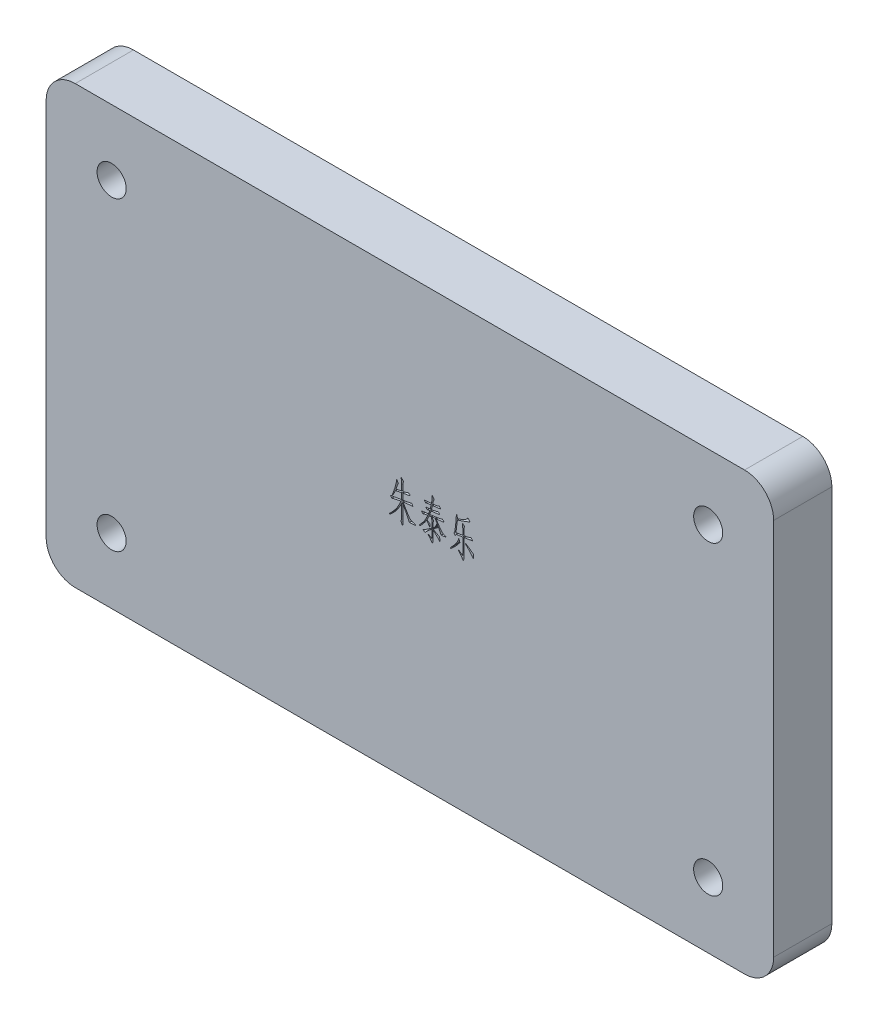
from build123d import *

# Parameters (mm, degrees)
SKETCH_1_R      = 10
EXTRUDE_1_DEPTH = 40


with BuildPart() as part:
    # 草图1 → 凸台-拉伸1 (new body)
    with BuildSketch(Plane.XY):
        with BuildLine():
            Line((-22.077417863, 16.871161249), (437.922582137, 16.871161249))
            ThreePointArc((437.922582137, 16.871161249), (452.064717761, 11.013296872), (457.922582137, -3.128838751))
            Line((457.922582137, -3.128838751), (457.922582137, -263.128838751))
            ThreePointArc((457.922582137, -263.128838751), (452.064717761, -277.270974375), (437.922582137, -283.128838751))
            Line((437.922582137, -283.128838751), (-22.077417863, -283.128838751))
            ThreePointArc((-22.077417863, -283.128838751), (-36.219553486, -277.270974375), (-42.077417863, -263.128838751))
            Line((-42.077417863, -263.128838751), (-42.077417863, -3.128838751))
            ThreePointArc((-42.077417863, -3.128838751), (-36.219553486, 11.013296872), (-22.077417863, 16.871161249))
        make_face()
        with Locations((2.922582137, -28.128838751)):
            Circle(SKETCH_1_R, mode=Mode.SUBTRACT)
        with Locations((2.922582137, -238.128838751)):
            Circle(SKETCH_1_R, mode=Mode.SUBTRACT)
        with Locations((412.922582137, -238.128838751)):
            Circle(SKETCH_1_R, mode=Mode.SUBTRACT)
        with Locations((412.922582137, -28.128838751)):
            Circle(SKETCH_1_R, mode=Mode.SUBTRACT)
        with BuildLine():
            Line((193.751266969, -131.102718666), (194.067492085, -130.73094049))
            add(Edge.make_bspline(
                [(194.067492085, -130.73094049), (194.100643812, -130.704317503), (194.185680249, -130.636027729), (194.325240939, -130.497087706), (194.522655672, -130.317368479), (194.721758842, -130.126010341), (194.9251429, -129.916227214), (195.137052053, -129.689496525), (195.40766143, -129.404376357), (195.727162645, -129.052992716), (196.099153866, -128.638654357), (196.520817568, -128.158961103), (197.000214479, -127.619796539), (197.534317143, -127.025667493), (198.088716776, -126.360751461), (198.6355987, -125.617277044), (199.176388913, -124.804468733), (199.715757452, -123.925399432), (200.240290283, -122.972137978), (200.761026668, -121.949935982), (201.278665359, -120.857640894), (201.605160603, -120.098584266), (201.772274287, -119.710067889)],
                knots=[0, 0, 0, 0, 0.187964212, 0.482141006, 0.869971959, 1.369031568, 1.7031997, 2.162277749, 2.741725131, 3.441883139, 4.262845846, 5.204671127, 6.266836653, 7.454056202, 8.73833837, 10.094250736, 11.534162965, 13.05561804, 14.654686024, 16.345366323, 18.129408288, 20, 20, 20, 20], degree=3))
            add(Edge.make_bspline(
                [(201.772274287, -119.710067889), (201.421774589, -119.773673023), (200.744451706, -119.896586719), (199.765099429, -120.082591737), (198.861601635, -120.272949292), (198.029726982, -120.449180048), (197.273963532, -120.630387861), (196.59020183, -120.802165471), (195.982855525, -120.978597236), (195.604256497, -121.098242694), (195.426405418, -121.15444747)],
                knots=[0, 0, 0, 0, 1.312670999, 2.536670107, 3.673164458, 4.715053788, 5.669917853, 6.53688696, 7.312686476, 8, 8, 8, 8], degree=3))
            Line((195.426405418, -121.15444747), (194.704215628, -120.257051872))
            add(Edge.make_bspline(
                [(194.704215628, -120.257051872), (194.669233953, -120.217992962), (194.608448281, -120.150122508), (194.537226422, -120.049972445), (194.491107063, -119.980997813), (194.462205534, -119.912348152), (194.523159416, -119.854416473), (194.628800997, -119.817288425), (194.802951594, -119.775686084), (194.940622452, -119.753084776), (195.020440743, -119.739981076)],
                knots=[0, 0, 0, 0, 1.256125566, 2.182698182, 2.901226033, 3.322543356, 3.758743219, 4.657992274, 6.062383352, 8, 8, 8, 8], degree=3))
            Line((195.020440743, -119.739981076), (197.704080911, -119.363929587))
            Line((197.704080911, -119.363929587), (199.981756404, -118.987878099))
            Line((199.981756404, -118.987878099), (202.289345084, -118.586186736))
            Line((202.289345084, -118.586186736), (202.289345084, -114.488080173))
            Line((202.289345084, -114.488080173), (198.020306027, -115.270096337))
            add(Edge.make_bspline(
                [(198.020306027, -115.270096337), (197.934818289, -115.456685513), (197.770224643, -115.815934614), (197.534321268, -116.331769708), (197.307283346, -116.796796969), (197.114022873, -117.223435828), (196.930309441, -117.599603812), (196.767221614, -117.931865736), (196.622645701, -118.216418071), (196.531879604, -118.39109621), (196.490460198, -118.470807302)],
                knots=[0, 0, 0, 0, 1.388358777, 2.673073827, 3.836746385, 4.888613906, 5.841025903, 6.668395757, 7.392347385, 8, 8, 8, 8], degree=3))
            Line((196.490460198, -118.470807302), (196.174235083, -119.017791285))
            Line((196.174235083, -119.017791285), (195.858009968, -118.671652983))
            Line((195.858009968, -118.671652983), (196.028942462, -118.325514681))
            add(Edge.make_bspline(
                [(196.028942462, -118.325514681), (196.064830977, -118.244442241), (196.15190403, -118.047743522), (196.297129824, -117.696345918), (196.474661432, -117.233462184), (196.763282279, -116.478119257), (197.128190775, -115.479580977), (197.518763689, -114.274355278), (197.86136368, -113.095194195), (198.112463709, -112.131240797), (198.289107418, -111.399057482), (198.402742283, -110.915567489), (198.488315059, -110.492043403), (198.551502404, -110.128371176), (198.601736007, -109.823823574), (198.627360825, -109.576551516), (198.654646315, -109.38915174), (198.656343798, -109.283240179), (198.65702957, -109.240452584)],
                knots=[0, 0, 0, 0, 0.448555804, 1.088290317, 1.92339773, 2.956674201, 5.179390362, 7.301161946, 9.365162416, 11.391066708, 12.340192607, 13.17582848, 13.903705564, 14.525740545, 15.043521023, 15.464543049, 15.783678808, 16, 16, 16, 16], degree=3))
            Line((198.65702957, -109.240452584), (198.56729001, -108.372970173))
            Line((198.56729001, -108.372970173), (198.827962064, -108.202037678))
            Line((198.827962064, -108.202037678), (200.067222652, -110.133574869))
            add(Edge.make_bspline(
                [(200.067222652, -110.133574869), (199.957914725, -110.249113873), (199.730308775, -110.489694456), (199.544669944, -110.834452556), (199.428432823, -111.121678412), (199.350632646, -111.354816405), (199.240725779, -111.656138858), (199.119817716, -112.033740948), (198.973242843, -112.480129053), (198.812334764, -113.001433162), (198.623065711, -113.59128497), (198.494165406, -114.010743265), (198.426270702, -114.231681431)],
                knots=[0, 0, 0, 0, 1.067939138, 2.223711576, 2.606838485, 3.156172787, 3.878504666, 4.767641592, 5.82674891, 7.043800617, 8.442902959, 10, 10, 10, 10], degree=3))
            Line((198.426270702, -114.231681431), (202.289345084, -113.479578454))
            Line((202.289345084, -113.479578454), (202.289345084, -109.642143946))
            add(Edge.make_bspline(
                [(202.289345084, -109.642143946), (202.28963371, -109.512520766), (202.290182438, -109.266085595), (202.286482239, -108.912770391), (202.27630483, -108.593770053), (202.270161636, -108.308723838), (202.25539073, -108.058151803), (202.24436321, -107.841422102), (202.228179139, -107.657387222), (202.19714926, -107.446295606), (202.145240606, -107.173884366), (202.062992754, -106.8064824), (201.956372394, -106.371872331), (201.87265312, -106.06093437), (201.827827348, -105.894448998)],
                knots=[0, 0, 0, 0, 1.229596448, 2.337666843, 3.351430766, 4.257141296, 5.041887779, 5.732193482, 6.315720038, 6.793443108, 7.755459236, 8.945517168, 10.364539649, 12, 12, 12, 12], degree=3))
            Line((201.827827348, -105.894448998), (202.088499402, -105.578223883))
            Line((202.088499402, -105.578223883), (203.558518857, -107.279002206))
            add(Edge.make_bspline(
                [(203.558518857, -107.279002206), (203.506640151, -107.388354504), (203.409877755, -107.592314686), (203.275603353, -107.89999122), (203.187309058, -108.240674729), (203.140523563, -108.566733605), (203.120992216, -108.884187117), (203.108201624, -109.180520015), (203.100070824, -109.525300139), (203.09806675, -109.771763733), (203.097001122, -109.902816001)],
                knots=[0, 0, 0, 0, 1.076880918, 2.008561614, 2.979719072, 4.196290932, 4.932849195, 5.807848978, 6.834365919, 8, 8, 8, 8], degree=3))
            Line((203.097001122, -109.902816001), (203.097001122, -113.334285834))
            add(Edge.make_bspline(
                [(203.097001122, -113.334285834), (203.330921474, -113.285825973), (203.780023168, -113.192788299), (204.423079482, -113.036270511), (205.010766742, -112.884947037), (205.540915451, -112.731202824), (206.013922927, -112.579067676), (206.42809516, -112.420247484), (206.789338931, -112.265314517), (207.004928271, -112.149146289), (207.105368124, -112.095025247)],
                knots=[0, 0, 0, 0, 1.361837192, 2.614579633, 3.772784231, 4.821369281, 5.761303325, 6.604402958, 7.349812186, 8, 8, 8, 8], degree=3))
            Line((207.105368124, -112.095025247), (207.942937349, -113.018060718))
            add(Edge.make_bspline(
                [(207.942937349, -113.018060718), (207.982590343, -113.073397597), (208.047357412, -113.163781881), (208.088847713, -113.310862974), (208.025388741, -113.420778035), (207.953477006, -113.439265454), (207.913024162, -113.449665268)],
                knots=[0, 0, 0, 0, 1.493413349, 2.439261119, 3.122030279, 4, 4, 4, 4], degree=3))
            Line((207.913024162, -113.449665268), (203.097001122, -114.317147679))
            Line((203.097001122, -114.317147679), (203.097001122, -118.470807302))
            add(Edge.make_bspline(
                [(203.097001122, -118.470807302), (203.456116141, -118.426438019), (204.142314247, -118.341657055), (205.121220025, -118.201410812), (206.002703282, -118.055045736), (206.787223878, -117.913066822), (207.474682195, -117.764668979), (208.063944889, -117.609555292), (208.561450935, -117.464512319), (208.851144185, -117.342113999), (208.981352254, -117.287099776)],
                knots=[0, 0, 0, 0, 1.442996166, 2.757281605, 3.943308322, 5.006225767, 5.936606997, 6.746759072, 7.436707337, 8, 8, 8, 8], degree=3))
            Line((208.981352254, -117.287099776), (209.818921479, -118.355427868))
            add(Edge.make_bspline(
                [(209.818921479, -118.355427868), (209.849470961, -118.408012273), (209.903923113, -118.501740013), (209.932054891, -118.645410054), (209.879022264, -118.771837742), (209.800389572, -118.781800441), (209.759095106, -118.787032417)],
                knots=[0, 0, 0, 0, 1.332594706, 2.375249681, 3.146751879, 4, 4, 4, 4], degree=3))
            Line((209.759095106, -118.787032417), (207.451506426, -118.962238224))
            Line((207.451506426, -118.962238224), (205.002898438, -119.27846334))
            Line((205.002898438, -119.27846334), (203.297846803, -119.539135394))
            Line((203.297846803, -119.539135394), (204.712313197, -122.077482942))
            Line((204.712313197, -122.077482942), (206.789143009, -125.479039588))
            add(Edge.make_bspline(
                [(206.789143009, -125.479039588), (206.878906871, -125.626666671), (207.051821121, -125.911044211), (207.32409419, -126.307170242), (207.580004407, -126.669622796), (207.844181865, -126.981392159), (208.098040789, -127.25701418), (208.352330568, -127.488180728), (208.597065217, -127.684584979), (208.943174969, -127.885604657), (209.42944853, -128.09886754), (210.102943941, -128.326327031), (210.897447375, -128.547955846), (211.473356393, -128.672945367), (211.780371856, -128.739576926)],
                knots=[0, 0, 0, 0, 0.997183308, 1.920897779, 2.774570547, 3.556858739, 4.278256875, 4.935961144, 5.539626952, 6.085404219, 7.240994938, 8.598500683, 10.186670367, 12, 12, 12, 12], degree=3))
            Line((211.780371856, -128.739576926), (211.780371856, -129.201094662))
            Line((211.780371856, -129.201094662), (207.626712233, -129.48740659))
            Line((207.626712233, -129.48740659), (204.887519004, -124.038933319))
            Line((204.887519004, -124.038933319), (203.097001122, -120.633103361))
            Line((203.097001122, -120.633103361), (203.067087935, -131.423217094))
            add(Edge.make_bspline(
                [(203.067087935, -131.423217094), (203.064812924, -131.604132905), (203.060549039, -131.943210113), (203.046120713, -132.417488029), (203.03516637, -132.823573511), (203.018489274, -133.161309365), (202.998521049, -133.429304447), (202.974636652, -133.629558375), (202.947049155, -133.761535416), (202.916783897, -133.849288842), (202.852617225, -133.892245583), (202.781132395, -133.857972023), (202.73216481, -133.779162999), (202.709139967, -133.711576325), (202.695309759, -133.6709794)],
                knots=[0, 0, 0, 0, 2.343960736, 4.393113347, 6.147126351, 7.606867474, 8.773131274, 9.629210383, 10.215690716, 10.521160351, 10.818723701, 11.07575951, 11.444841421, 12, 12, 12, 12], degree=3))
            Line((202.695309759, -133.6709794), (202.058586216, -132.141133572))
            add(Edge.make_bspline(
                [(202.058586216, -132.141133572), (202.012825417, -132.0388077), (201.932975769, -131.860255638), (201.833518394, -131.630501273), (201.775969424, -131.482442132), (201.747278122, -131.38509043), (201.776703656, -131.31311623), (201.81698038, -131.227277707), (201.869494401, -131.10355228), (201.974139565, -130.906516513), (202.086704831, -130.648018772), (202.157292105, -130.377664299), (202.186369782, -130.153210861), (202.195080669, -129.951743944), (202.210550498, -129.712639904), (202.216705691, -129.448944833), (202.222920456, -129.180994209), (202.239107089, -128.93626858), (202.244140758, -128.725112772), (202.254642832, -128.597104479), (202.259431897, -128.538731244)],
                knots=[0, 0, 0, 0, 1.618232742, 2.823712003, 3.590537451, 3.945084, 4.224435491, 4.674876236, 5.327594578, 6.154246419, 7.893710821, 9.378164718, 10.165348301, 11.153111738, 12.284399055, 13.620022312, 14.955645568, 16.148461142, 17.155677268, 18, 18, 18, 18], degree=3))
            Line((202.259431897, -128.538731244), (202.289345084, -121.039068036))
            add(Edge.make_bspline(
                [(202.289345084, -121.039068036), (202.02456271, -121.53072696), (201.505745884, -122.494087617), (200.691808833, -123.882730542), (199.845242445, -125.175977799), (198.994358504, -126.396547393), (198.105894296, -127.52955449), (197.182803453, -128.583505121), (196.218792749, -129.558467006), (195.534360206, -130.148405192), (195.19564655, -130.440355249)],
                knots=[0, 0, 0, 0, 1.130599819, 2.215306855, 3.257628486, 4.259413885, 5.226941431, 6.171091226, 7.094905138, 8, 8, 8, 8], degree=3))
            Line((195.19564655, -130.440355249), (194.272611079, -131.2180981))
            Line((194.272611079, -131.2180981), (193.866646403, -131.564236402))
            Line((193.866646403, -131.564236402), (193.751266969, -131.102718666))
        make_face(mode=Mode.SUBTRACT)
        with BuildLine():
            Line((214.481105274, -127.410576779), (215.228934938, -126.602920741))
            add(Edge.make_bspline(
                [(215.228934938, -126.602920741), (215.439064642, -126.372825437), (215.847271596, -125.925832455), (216.428202827, -125.265507556), (216.956733133, -124.633464565), (217.425150292, -124.024182345), (217.85072137, -123.450694866), (218.218104846, -122.902002773), (218.538359101, -122.385068356), (218.879046201, -121.744566026), (219.234696237, -121.003604322), (219.639008965, -120.202121374), (219.974021646, -119.491502597), (220.180368847, -119.05059255), (220.275716847, -118.84685879)],
                knots=[0, 0, 0, 0, 1.204587963, 2.34008412, 3.399773012, 4.388879473, 5.310738458, 6.159899105, 6.940925196, 7.660354251, 8.96309413, 10.11807748, 11.130409584, 12, 12, 12, 12], degree=3))
            add(Edge.make_bspline(
                [(220.275716847, -118.84685879), (220.004551664, -118.886617691), (219.44805122, -118.968213145), (218.599789185, -119.152049043), (217.715004752, -119.385349652), (217.119664458, -119.580214747), (216.814333828, -119.680154702)],
                knots=[0, 0, 0, 0, 0.922075282, 1.892334773, 2.919047211, 4, 4, 4, 4], degree=3))
            Line((216.814333828, -119.680154702), (216.00667779, -118.757119231))
            add(Edge.make_bspline(
                [(216.00667779, -118.757119231), (215.976666327, -118.719639836), (215.920554693, -118.649565608), (215.883632784, -118.509971435), (215.984863383, -118.381433948), (216.089705076, -118.365117929), (216.15197041, -118.355427868)],
                knots=[0, 0, 0, 0, 0.997517539, 1.865032041, 2.732045523, 4, 4, 4, 4], degree=3))
            add(Edge.make_bspline(
                [(216.15197041, -118.355427868), (216.377026505, -118.336891715), (216.798727854, -118.302159392), (217.384644081, -118.25417821), (217.879798737, -118.199994451), (218.178935613, -118.168727496), (218.314266469, -118.154582187)],
                knots=[0, 0, 0, 0, 1.247797595, 2.338074553, 3.248137516, 4, 4, 4, 4], degree=3))
            Line((218.314266469, -118.154582187), (220.681681522, -117.893910132))
            add(Edge.make_bspline(
                [(220.681681522, -117.893910132), (220.764166978, -117.663104899), (220.925042616, -117.212953555), (221.162094672, -116.556572153), (221.375798123, -115.930703191), (221.509642111, -115.523766006), (221.574803807, -115.325649398)],
                knots=[0, 0, 0, 0, 1.081630591, 2.109559896, 3.079642767, 4, 4, 4, 4], degree=3))
            add(Edge.make_bspline(
                [(221.574803807, -115.325649398), (221.397843, -115.358250649), (221.063877561, -115.419776652), (220.598803285, -115.530212467), (220.196671372, -115.647370816), (219.956059562, -115.742777933), (219.844112298, -115.787167134)],
                knots=[0, 0, 0, 0, 1.202905152, 2.270156622, 3.195171529, 4, 4, 4, 4], degree=3))
            Line((219.844112298, -115.787167134), (218.980903199, -114.979511096))
            add(Edge.make_bspline(
                [(218.980903199, -114.979511096), (218.950578302, -114.949419835), (218.892341466, -114.891631682), (218.86412567, -114.780432069), (218.909576256, -114.692517016), (218.999061747, -114.640412257), (219.133134566, -114.60671888), (219.23711374, -114.588395563), (219.297128314, -114.577819733)],
                knots=[0, 0, 0, 0, 1.052663628, 2.021566598, 2.573869921, 3.386200027, 4.491370104, 6, 6, 6, 6], degree=3))
            Line((219.297128314, -114.577819733), (219.814199111, -114.547906547))
            add(Edge.make_bspline(
                [(219.814199111, -114.547906547), (219.845561712, -114.546821292), (219.932755664, -114.543804079), (220.09763741, -114.523088301), (220.335831511, -114.499274535), (220.517929674, -114.475823862), (220.621855149, -114.462440299)],
                knots=[0, 0, 0, 0, 0.463376835, 1.288275088, 2.452388022, 4, 4, 4, 4], degree=3))
            Line((220.621855149, -114.462440299), (221.865389048, -114.317147679))
            add(Edge.make_bspline(
                [(221.865389048, -114.317147679), (221.986681778, -113.880943877), (222.236238312, -112.983466274), (222.428788195, -112.072038204), (222.527752466, -111.603594324)],
                knots=[0, 0, 0, 0, 0.972066155, 2, 2, 2, 2], degree=3))
            add(Edge.make_bspline(
                [(222.527752466, -111.603594324), (222.293995497, -111.635355336), (221.848823952, -111.695841655), (221.217298541, -111.797470232), (220.652106449, -111.883476241), (220.156770109, -111.974418613), (219.729070142, -112.058630118), (219.369986836, -112.139655302), (219.078124702, -112.213444348), (218.909418093, -112.270784962), (218.835610578, -112.295870928)],
                knots=[0, 0, 0, 0, 1.505363151, 2.866844326, 4.081825289, 5.153414892, 6.080425348, 6.86328174, 7.502696723, 8, 8, 8, 8], degree=3))
            Line((218.835610578, -112.295870928), (218.02795454, -111.347195582))
            add(Edge.make_bspline(
                [(218.02795454, -111.347195582), (217.990018718, -111.309820036), (217.933283939, -111.253923176), (217.881863716, -111.151059681), (217.921736285, -111.092262447), (217.952282789, -111.032784156), (218.056426707, -111.018169435), (218.210103456, -110.989132427), (218.464688854, -110.969118058), (218.662182825, -110.95141434), (218.775784205, -110.941230907)],
                knots=[0, 0, 0, 0, 1.097726399, 1.641700688, 2.052192079, 2.442145727, 2.922741873, 3.997387523, 5.697639574, 8, 8, 8, 8], degree=3))
            Line((218.775784205, -110.941230907), (219.698819677, -110.885677846))
            Line((219.698819677, -110.885677846), (221.344044939, -110.770298412))
            Line((221.344044939, -110.770298412), (222.728598147, -110.625005791))
            add(Edge.make_bspline(
                [(222.728598147, -110.625005791), (222.763629094, -110.452809149), (222.831248494, -110.120422079), (222.91541835, -109.636962846), (222.988869981, -109.188340638), (223.048452068, -108.773739411), (223.097292023, -108.395068896), (223.126709709, -108.04998334), (223.145013571, -107.739314441), (223.149347263, -107.377254391), (223.140870296, -106.972597544), (223.123234665, -106.529621585), (223.103215495, -106.137747831), (223.083781805, -105.892990957), (223.074736449, -105.779069564)],
                knots=[0, 0, 0, 0, 1.296175992, 2.50197758, 3.619632, 4.649420737, 5.591704021, 6.435515913, 7.203714152, 7.886782559, 9.105833862, 10.188922305, 11.157039023, 12, 12, 12, 12], degree=3))
            Line((223.074736449, -105.779069564), (223.335408503, -105.51839751))
            Line((223.335408503, -105.51839751), (224.634495464, -107.509761074))
            add(Edge.make_bspline(
                [(224.634495464, -107.509761074), (224.574277675, -107.57814317), (224.455502463, -107.713021885), (224.30943958, -107.939638134), (224.189476597, -108.179130444), (224.11049784, -108.394876505), (224.052774949, -108.588219318), (224.013648744, -108.767948351), (223.959990189, -108.977825543), (223.9039287, -109.221072906), (223.852057644, -109.498769369), (223.783789331, -109.806468573), (223.723751597, -110.148268693), (223.676346797, -110.385797368), (223.651633619, -110.509626358)],
                knots=[0, 0, 0, 0, 1.023618767, 2.019013623, 3.022114876, 4.030957296, 4.598758827, 5.290469846, 6.098719696, 7.035392193, 8.09740992, 9.275721729, 10.579773043, 12, 12, 12, 12], degree=3))
            Line((223.651633619, -110.509626358), (225.58317081, -110.27886749))
            add(Edge.make_bspline(
                [(225.58317081, -110.27886749), (225.829301261, -110.247514015), (226.297465468, -110.187876637), (226.947410803, -110.014946926), (227.523079722, -109.818425128), (227.850686274, -109.620623433), (228.006138923, -109.526764513)],
                knots=[0, 0, 0, 0, 1.161977707, 2.210195322, 3.15071943, 4, 4, 4, 4], degree=3))
            Line((228.006138923, -109.526764513), (228.929174395, -110.449799984))
            add(Edge.make_bspline(
                [(228.929174395, -110.449799984), (228.961265039, -110.500588934), (229.017204222, -110.589122291), (229.0475023, -110.728112941), (228.990406309, -110.845596902), (228.914631399, -110.852194162), (228.873621334, -110.855764659)],
                knots=[0, 0, 0, 0, 1.367035271, 2.382963634, 3.124845346, 4, 4, 4, 4], degree=3))
            Line((228.873621334, -110.855764659), (223.450787937, -111.518128077))
            add(Edge.make_bspline(
                [(223.450787937, -111.518128077), (223.390955456, -111.734279685), (223.263922587, -112.19320029), (223.100283505, -112.898022287), (222.946019727, -113.590705717), (222.817528038, -114.029939667), (222.758511334, -114.231681431)],
                knots=[0, 0, 0, 0, 0.960764135, 2.039838902, 3.099690818, 4, 4, 4, 4], degree=3))
            Line((222.758511334, -114.231681431), (224.544755904, -114.000922563))
            add(Edge.make_bspline(
                [(224.544755904, -114.000922563), (224.813600563, -113.962020645), (225.330214362, -113.887266443), (226.061669127, -113.694653905), (226.7268244, -113.46066594), (227.122666376, -113.240016305), (227.313862319, -113.133440152)],
                knots=[0, 0, 0, 0, 1.114638722, 2.141897649, 3.102516528, 4, 4, 4, 4], degree=3))
            Line((227.313862319, -113.133440152), (228.121518357, -114.086388811))
            add(Edge.make_bspline(
                [(228.121518357, -114.086388811), (228.168985247, -114.144061933), (228.24880924, -114.241049516), (228.284309679, -114.404977864), (228.226730186, -114.526137961), (228.155783651, -114.540816973), (228.121518357, -114.547906547)],
                knots=[0, 0, 0, 0, 1.528933803, 2.571173353, 3.309914628, 4, 4, 4, 4], degree=3))
            Line((228.121518357, -114.547906547), (222.467926092, -115.240183151))
            add(Edge.make_bspline(
                [(222.467926092, -115.240183151), (222.414280792, -115.411270316), (222.298640431, -115.780073951), (222.10165877, -116.370235274), (221.866138913, -117.034847013), (221.694911654, -117.502355501), (221.604716994, -117.748617511)],
                knots=[0, 0, 0, 0, 0.810954206, 1.748131472, 2.813819033, 4, 4, 4, 4], degree=3))
            Line((221.604716994, -117.748617511), (225.382325128, -117.257186589))
            add(Edge.make_bspline(
                [(225.382325128, -117.257186589), (225.688789224, -117.21731595), (226.272559324, -117.141368108), (227.101102412, -117.010847022), (227.840793673, -116.888145981), (228.485234038, -116.748849394), (229.040785721, -116.61731005), (229.500259999, -116.470826416), (229.875181104, -116.332978711), (230.081236526, -116.215409669), (230.172708295, -116.163218622)],
                knots=[0, 0, 0, 0, 1.501851041, 2.860810596, 4.076304916, 5.144842173, 6.06493159, 6.84875319, 7.4889405, 8, 8, 8, 8], degree=3))
            Line((230.172708295, -116.163218622), (231.2111232, -117.257186589))
            add(Edge.make_bspline(
                [(231.2111232, -117.257186589), (231.226467687, -117.289475602), (231.259208017, -117.358370244), (231.256670661, -117.468281892), (231.217288506, -117.588964629), (231.137824603, -117.598353126), (231.095743766, -117.603324891)],
                knots=[0, 0, 0, 0, 0.949316421, 2.025543975, 2.954408762, 4, 4, 4, 4], degree=3))
            Line((231.095743766, -117.603324891), (226.019048671, -118.154582187))
            Line((226.019048671, -118.154582187), (226.566032655, -119.192997092))
            Line((226.566032655, -119.192997092), (227.172843011, -120.201498811))
            Line((227.172843011, -120.201498811), (228.382190412, -122.077482942))
            add(Edge.make_bspline(
                [(228.382190412, -122.077482942), (228.444764217, -122.178240215), (228.576667463, -122.390632784), (228.816607583, -122.703379105), (229.084991274, -123.044178635), (229.390652148, -123.392987275), (229.712667162, -123.738581286), (230.05345528, -124.043918522), (230.38615549, -124.321339762), (230.732846789, -124.566213153), (231.124612889, -124.777012367), (231.576679083, -124.966800999), (232.103108043, -125.137766065), (232.481004461, -125.229572295), (232.681142655, -125.278193906)],
                knots=[0, 0, 0, 0, 0.772128462, 1.627617958, 2.565163869, 3.597753307, 4.647828339, 5.639591055, 6.575758559, 7.468911476, 8.398989721, 9.467473198, 10.658745312, 12, 12, 12, 12], degree=3))
            Line((232.681142655, -125.278193906), (232.681142655, -125.795264703))
            Line((232.681142655, -125.795264703), (229.450518504, -126.141403005))
            Line((229.450518504, -126.141403005), (228.583036093, -124.440624682))
            Line((228.583036093, -124.440624682), (228.03605211, -123.37229659))
            Line((228.03605211, -123.37229659), (225.296858881, -118.240048434))
            Line((225.296858881, -118.240048434), (223.019183388, -118.500720488))
            Line((223.019183388, -118.500720488), (224.198617602, -120.116032564))
            add(Edge.make_bspline(
                [(224.198617602, -120.116032564), (224.139167205, -120.310157024), (224.030439711, -120.665186886), (223.93183366, -121.182576856), (223.888346331, -121.672095231), (223.884432262, -121.994783577), (223.882392487, -122.162949189)],
                knots=[0, 0, 0, 0, 1.16993673, 2.13967099, 3.030509248, 4, 4, 4, 4], degree=3))
            Line((223.882392487, -122.162949189), (223.882392487, -124.846589357))
            add(Edge.make_bspline(
                [(223.882392487, -124.846589357), (223.987437845, -124.718092761), (224.188522862, -124.472115777), (224.482628165, -124.124038731), (224.738647899, -123.796578306), (224.967194392, -123.499703192), (225.171152268, -123.234164578), (225.340980721, -122.995361125), (225.483117057, -122.786539458), (225.702159154, -122.431689134), (225.9809563, -121.890009616), (226.15890618, -121.383349339), (226.249807539, -121.124534283)],
                knots=[0, 0, 0, 0, 1.120293098, 2.14454177, 3.075552197, 3.925589571, 4.673640355, 5.335325817, 5.903339057, 6.378281147, 8.14993318, 10, 10, 10, 10], degree=3))
            Line((226.249807539, -121.124534283), (226.506206282, -121.094621097))
            Line((226.506206282, -121.094621097), (226.942084143, -123.201364095))
            add(Edge.make_bspline(
                [(226.942084143, -123.201364095), (226.769677759, -123.254076678), (226.436773643, -123.355860821), (226.094108213, -123.562673365), (225.871397855, -123.738602078), (225.7149997, -123.865803334), (225.517016373, -124.029623399), (225.278142398, -124.229326971), (225.001963576, -124.469074285), (224.684016096, -124.743641155), (224.325459025, -125.054431549), (224.074481434, -125.276529851), (223.94221886, -125.39357334)],
                knots=[0, 0, 0, 0, 1.438611379, 2.777853342, 3.167792367, 3.710818861, 4.391006554, 5.224452859, 6.202527906, 7.317862354, 8.586541427, 10, 10, 10, 10], degree=3))
            Line((223.94221886, -125.39357334), (227.920672676, -127.615695773))
            Line((227.920672676, -127.615695773), (228.266810978, -127.786628267))
            add(Edge.make_bspline(
                [(228.266810978, -127.786628267), (228.282014584, -127.813268731), (228.31804411, -127.876401337), (228.353458584, -128.001659873), (228.386580667, -128.167329629), (228.403002324, -128.293563573), (228.412103598, -128.363525437)],
                knots=[0, 0, 0, 0, 0.612617375, 1.451781485, 2.587716485, 4, 4, 4, 4], degree=3))
            Line((228.412103598, -128.363525437), (228.583036093, -130.008750699))
            add(Edge.make_bspline(
                [(228.583036093, -130.008750699), (228.581770946, -130.047366229), (228.577975505, -130.163212817), (228.567332627, -130.309970802), (228.572544712, -130.451607515), (228.490839216, -130.510375568), (228.406804878, -130.422086576), (228.358087149, -130.36307246), (228.326637351, -130.324975815)],
                knots=[0, 0, 0, 0, 0.917355376, 2.752066127, 3.617697242, 4.060388189, 4.747880917, 6, 6, 6, 6], degree=3))
            Line((228.326637351, -130.324975815), (228.006138923, -129.923284452))
            add(Edge.make_bspline(
                [(228.006138923, -129.923284452), (227.884113432, -129.779010769), (227.646735557, -129.498353178), (227.292116508, -129.095137454), (226.947362986, -128.725930065), (226.660283836, -128.430265787), (226.412347801, -128.186573333), (226.17959289, -127.975099613), (225.909344254, -127.722265265), (225.589048329, -127.440282227), (225.229061188, -127.118899275), (224.815668088, -126.770919697), (224.36479325, -126.381036552), (224.047820753, -126.111264708), (223.882392487, -125.97047051)],
                knots=[0, 0, 0, 0, 1.188864515, 2.312714579, 3.378044508, 4.366730399, 4.905430465, 5.564987527, 6.345108029, 7.233764653, 8.249696585, 9.381203484, 10.633247447, 12, 12, 12, 12], degree=3))
            Line((223.882392487, -125.97047051), (223.882392487, -130.324975815))
            add(Edge.make_bspline(
                [(223.882392487, -130.324975815), (223.880992943, -130.380527779), (223.877547326, -130.517294347), (223.870598284, -130.761129112), (223.845313659, -131.081268653), (223.822840211, -131.451721083), (223.799321004, -131.82212011), (223.775164671, -132.142363875), (223.76563564, -132.390590383), (223.750407516, -132.582748029), (223.737247276, -132.753929318), (223.715524883, -132.93938758), (223.680636761, -133.157329652), (223.63592635, -133.392431532), (223.59174316, -133.613346677), (223.538891103, -133.786626626), (223.484023115, -133.897680473), (223.405290355, -133.963879659), (223.30576023, -133.923076991), (223.215389508, -133.828992561), (223.088191599, -133.687989715), (223.006081384, -133.568208023), (222.959357015, -133.500046905)],
                knots=[0, 0, 0, 0, 0.767003296, 1.888329408, 3.366124187, 5.198332357, 7.010921469, 8.488716248, 9.630537376, 10.438764193, 11.148987891, 12.000076342, 13.015012, 14.194956983, 15.301710788, 16.128612365, 16.674871301, 17.029302207, 17.396586721, 17.995822534, 18.859533748, 20, 20, 20, 20], degree=3))
            Line((222.959357015, -133.500046905), (222.467926092, -132.807770301))
            Line((222.467926092, -132.807770301), (221.660270055, -131.709529023))
            Line((221.660270055, -131.709529023), (220.450922654, -130.295062628))
            Line((220.450922654, -130.295062628), (220.651768335, -129.807905018))
            Line((220.651768335, -129.807905018), (222.12178779, -130.871959798))
            add(Edge.make_bspline(
                [(222.12178779, -130.871959798), (222.223528905, -130.948602773), (222.398992795, -131.080782123), (222.631451857, -131.252039782), (222.771298584, -131.339232566), (222.855610084, -131.424545726), (222.912411679, -131.387557138), (222.940018786, -131.320011064), (222.973171299, -131.213999163), (223.009527504, -131.05432933), (223.036939709, -130.822734372), (223.062905449, -130.503546483), (223.072305699, -130.085711878), (223.073868946, -129.775135894), (223.074736449, -129.602786024)],
                knots=[0, 0, 0, 0, 1.666996254, 2.874920798, 3.656591931, 3.996613968, 4.145944563, 4.444605751, 4.930790941, 5.595786236, 6.567627243, 7.961229022, 9.758739611, 12, 12, 12, 12], degree=3))
            Line((223.074736449, -129.602786024), (223.074736449, -125.739711642))
            add(Edge.make_bspline(
                [(223.074736449, -125.739711642), (222.835032279, -125.937229745), (222.381522854, -126.310925041), (221.747556368, -126.845551349), (221.18908204, -127.312371292), (220.711783217, -127.715162076), (220.318030824, -128.059637601), (220.000053373, -128.336876059), (219.762933116, -128.551334116), (219.546990826, -128.758889429), (219.327707008, -129.005473608), (219.049402482, -129.317648807), (218.751140595, -129.689656123), (218.540638245, -129.95454698), (218.429645903, -130.094216947)],
                knots=[0, 0, 0, 0, 1.75108217, 3.312968087, 4.675375631, 5.854797308, 6.833885805, 7.624860068, 8.233130246, 8.636348814, 9.312695054, 10.092336251, 10.994139184, 12, 12, 12, 12], degree=3))
            Line((218.429645903, -130.094216947), (217.365591123, -129.401940343))
            add(Edge.make_bspline(
                [(217.365591123, -129.401940343), (217.319215723, -129.371668627), (217.238125468, -129.318736659), (217.142571574, -129.237557299), (217.082589689, -129.171250921), (217.065141872, -129.092108982), (217.137601553, -129.022312879), (217.243431508, -128.940050521), (217.412363961, -128.828755189), (217.546131523, -128.75275994), (217.621989865, -128.709663739)],
                knots=[0, 0, 0, 0, 1.195118225, 2.089738122, 2.705255323, 3.110048562, 3.682512651, 4.667820928, 6.110352168, 8, 8, 8, 8], degree=3))
            Line((217.621989865, -128.709663739), (218.344179656, -128.27805919))
            Line((218.344179656, -128.27805919), (219.527887182, -127.555869399))
            Line((219.527887182, -127.555869399), (221.027819824, -126.517454494))
            Line((221.027819824, -126.517454494), (223.074736449, -125.077348225))
            Line((223.074736449, -125.077348225), (223.074736449, -122.449261118))
            add(Edge.make_bspline(
                [(223.074736449, -122.449261118), (223.072267814, -122.131518548), (223.067602932, -121.531092816), (223.018975722, -120.788579531), (222.95592681, -120.201701619), (222.880858681, -119.716269204), (222.786298181, -119.17072051), (222.712209835, -118.788327952), (222.673045086, -118.586186736)],
                knots=[0, 0, 0, 0, 1.469336668, 2.776548147, 3.439311233, 4.198635673, 5.047758726, 6, 6, 6, 6], degree=3))
            Line((222.673045086, -118.586186736), (221.258578692, -118.757119231))
            add(Edge.make_bspline(
                [(221.258578692, -118.757119231), (221.206529749, -118.846437521), (221.092874782, -119.041474477), (220.926764049, -119.366833271), (220.730714265, -119.736707273), (220.463778753, -120.302618821), (220.099778704, -121.03024018), (219.795147895, -121.612151), (219.643266616, -121.902277135)],
                knots=[0, 0, 0, 0, 0.52610368, 1.148809042, 1.858994882, 2.656722354, 4.333125646, 6, 6, 6, 6], degree=3))
            Line((219.643266616, -121.902277135), (220.305630033, -122.333881684))
            Line((220.305630033, -122.333881684), (220.967993451, -122.79539942))
            Line((220.967993451, -122.79539942), (221.604716994, -123.231277281))
            add(Edge.make_bspline(
                [(221.604716994, -123.231277281), (221.679918595, -123.291995439), (221.811667312, -123.398370026), (221.892325339, -123.635246771), (221.882770047, -123.871307193), (221.871544032, -124.034774145), (221.865389048, -124.124399567)],
                knots=[0, 0, 0, 0, 1.148056734, 2.011326859, 2.90965319, 4, 4, 4, 4], degree=3))
            Line((221.865389048, -124.124399567), (221.720096428, -124.872229231))
            add(Edge.make_bspline(
                [(221.720096428, -124.872229231), (221.711037537, -124.933511983), (221.694918048, -125.042559187), (221.662045954, -125.186790056), (221.624808333, -125.286178151), (221.602728771, -125.363862437), (221.534171109, -125.386958405), (221.480034688, -125.316407002), (221.412479477, -125.222991357), (221.369641196, -125.131822459), (221.344044939, -125.077348225)],
                knots=[0, 0, 0, 0, 1.617360577, 2.877949255, 3.81712904, 4.44824283, 4.835832326, 5.415733064, 6.455877325, 8, 8, 8, 8], degree=3))
            Line((221.344044939, -125.077348225), (221.143199258, -124.67138355))
            add(Edge.make_bspline(
                [(221.143199258, -124.67138355), (221.047382927, -124.501777929), (220.839183294, -124.133241295), (220.444476469, -123.570068154), (219.951254384, -122.952729339), (219.579706138, -122.531637147), (219.382594562, -122.30824181)],
                knots=[0, 0, 0, 0, 0.791033312, 1.71883899, 2.789811959, 4, 4, 4, 4], degree=3))
            add(Edge.make_bspline(
                [(219.382594562, -122.30824181), (219.327729917, -122.383227539), (219.226198406, -122.521994762), (219.096377891, -122.720934827), (218.982667739, -122.882044946), (218.919335479, -122.98178937), (218.891163639, -123.026158288)],
                knots=[0, 0, 0, 0, 1.281106573, 2.370792434, 3.275286034, 4, 4, 4, 4], degree=3))
            Line((218.891163639, -123.026158288), (218.057867727, -124.239779001))
            add(Edge.make_bspline(
                [(218.057867727, -124.239779001), (217.869658484, -124.4954037), (217.488927307, -125.012510569), (216.861223954, -125.758910172), (216.185769474, -126.496530728), (215.704043505, -126.969714385), (215.459693806, -127.209731097)],
                knots=[0, 0, 0, 0, 0.96379706, 1.949678893, 2.959999304, 4, 4, 4, 4], degree=3))
            Line((215.459693806, -127.209731097), (214.711864142, -127.931920888))
            Line((214.711864142, -127.931920888), (214.481105274, -127.410576779))
        make_face(mode=Mode.SUBTRACT)
        with BuildLine():
            Line((235.668188002, -130.440355249), (236.04423949, -130.06430376))
            add(Edge.make_bspline(
                [(236.04423949, -130.06430376), (236.401184665, -129.714616188), (237.093859104, -129.03602558), (238.043266727, -127.987589482), (238.895245564, -126.962103404), (239.510491198, -126.10223904), (239.948875234, -125.448352812), (240.235903443, -125.010868933), (240.478299704, -124.615153351), (240.690377357, -124.269970248), (240.861590236, -123.966466988), (240.995610201, -123.708264167), (241.088007753, -123.492211219), (241.190378899, -123.173607223), (241.270184848, -122.733904089), (241.284769796, -122.349840894), (241.29186708, -122.162949189)],
                knots=[0, 0, 0, 0, 2.168776135, 4.208645744, 6.137373758, 7.953191284, 8.795287015, 9.555101831, 10.224342182, 10.809739215, 11.313662918, 11.736783111, 12.072130986, 12.332213984, 13.188426865, 14, 14, 14, 14], degree=3))
            Line((241.29186708, -122.162949189), (241.638005382, -122.103122816))
            Line((241.638005382, -122.103122816), (242.360195172, -124.355158435))
            add(Edge.make_bspline(
                [(242.360195172, -124.355158435), (242.265588074, -124.41555148), (242.098659591, -124.522111343), (241.882870317, -124.675311545), (241.716194433, -124.80749255), (241.606624384, -124.932814751), (241.505598046, -125.063884488), (241.393857938, -125.227149547), (241.228461609, -125.448592855), (241.063987564, -125.676680342), (240.90073695, -125.895096461), (240.745149874, -126.092895006), (240.563841494, -126.317435572), (240.351255171, -126.565479002), (240.11929388, -126.843019197), (239.855425655, -127.143505809), (239.566164296, -127.471039184), (239.147576012, -127.942182646), (238.599540902, -128.533964099), (237.905581537, -129.207327489), (237.192993904, -129.84860336), (236.694483977, -130.243475239), (236.445930853, -130.440355249)],
                knots=[0, 0, 0, 0, 0.789636058, 1.393264895, 1.863020799, 2.281769811, 2.560475495, 3.027764908, 3.673382645, 4.505463807, 5.006681143, 5.592226565, 6.276383638, 7.037508197, 7.891050562, 8.821804542, 9.851583582, 10.966271104, 13.257113983, 15.525541914, 17.769070435, 20, 20, 20, 20], degree=3))
            Line((236.445930853, -130.440355249), (235.843393809, -130.901872985))
            Line((235.843393809, -130.901872985), (235.668188002, -130.440355249))
        make_face(mode=Mode.SUBTRACT)
        with BuildLine():
            Line((239.791934438, -108.462709733), (240.082519679, -108.432796546))
            Line((240.082519679, -108.432796546), (240.744883097, -110.855764659))
            add(Edge.make_bspline(
                [(240.744883097, -110.855764659), (241.040273268, -110.746027561), (241.610164766, -110.534313544), (242.427126672, -110.205473191), (243.185496813, -109.898392594), (243.873435648, -109.588004424), (244.50286303, -109.301193478), (245.061225824, -109.011416842), (245.562540481, -108.743218193), (245.995231478, -108.474834108), (246.370309257, -108.226016966), (246.697706341, -108.003996304), (246.974540503, -107.802973295), (247.205167661, -107.629627323), (247.386946136, -107.481303202), (247.51588524, -107.356004791), (247.606874503, -107.258210878), (247.629127334, -107.190007554), (247.637735949, -107.163622772)],
                knots=[0, 0, 0, 0, 1.915841897, 3.696202912, 5.354426652, 6.88981103, 8.284713139, 9.559060124, 10.714069952, 11.74047698, 12.653279185, 13.450826893, 14.145530052, 14.732743505, 15.20624538, 15.567620402, 15.832731886, 16, 16, 16, 16], degree=3))
            Line((247.637735949, -107.163622772), (247.727475508, -106.732018223))
            Line((247.727475508, -106.732018223), (247.92832119, -106.67219185))
            Line((247.92832119, -106.67219185), (249.022289156, -108.257590739))
            add(Edge.make_bspline(
                [(249.022289156, -108.257590739), (249.059803828, -108.316860612), (249.115491792, -108.404842684), (249.166566073, -108.535770257), (249.117316662, -108.609664564), (249.045145302, -108.660588938), (248.925467547, -108.695043443), (248.794957202, -108.721527783), (248.648818256, -108.744608506), (248.493665765, -108.792918715), (248.295000693, -108.850197941), (248.098555185, -108.913620884), (247.904078112, -108.981109433), (247.707802956, -109.047808706), (247.469681302, -109.139416305), (247.187367699, -109.245495605), (246.861716025, -109.370860824), (246.49001788, -109.509803472), (246.076614798, -109.673651796), (245.619868829, -109.852960393), (245.123861375, -110.045470745), (244.58642143, -110.239942724), (244.015886964, -110.452316703), (243.402588941, -110.662636307), (242.756179542, -110.891213971), (242.070123755, -111.120836555), (241.348104264, -111.360670408), (240.853238557, -111.521274952), (240.599590476, -111.603594324)],
                knots=[0, 0, 0, 0, 0.59659428, 0.88560339, 1.049380405, 1.285158954, 1.609515178, 2.067314312, 2.391027184, 2.831497865, 3.409636292, 4.10308181, 4.539272127, 5.113430415, 5.818502899, 6.650520602, 7.609490254, 8.706430793, 9.934574529, 11.289685975, 12.767492809, 14.337723075, 16.019743187, 17.805639247, 19.703363656, 21.69412225, 23.792981792, 26, 26, 26, 26], degree=3))
            Line((240.599590476, -111.603594324), (239.535535696, -119.594688455))
            Line((239.535535696, -119.594688455), (244.266092489, -118.84685879))
            Line((244.266092489, -118.84685879), (244.266092489, -114.808578601))
            add(Edge.make_bspline(
                [(244.266092489, -114.808578601), (244.262954538, -114.656113362), (244.256027672, -114.319554107), (244.219713352, -113.801144254), (244.181187891, -113.294560711), (244.129094454, -112.906149575), (244.081482736, -112.618292319), (244.027866987, -112.3753881), (243.964881202, -112.090251571), (243.916035458, -111.886977437), (243.890041001, -111.778800131)],
                knots=[0, 0, 0, 0, 1.195488496, 2.638980002, 4.073804413, 5.177895596, 5.71036016, 6.360913517, 7.12772001, 8, 8, 8, 8], degree=3))
            Line((243.890041001, -111.778800131), (244.120799869, -111.57795445))
            Line((244.120799869, -111.57795445), (245.535266263, -113.133440152))
            add(Edge.make_bspline(
                [(245.535266263, -113.133440152), (245.481234884, -113.246297572), (245.376564302, -113.464927046), (245.269428023, -113.800746382), (245.185138896, -114.123783008), (245.148480907, -114.54016917), (245.137149587, -115.036328604), (245.13186571, -115.426766007), (245.129301588, -115.616234639)],
                knots=[0, 0, 0, 0, 0.88373349, 1.7119848, 2.488966461, 3.238763405, 4.660047132, 6, 6, 6, 6], degree=3))
            Line((245.129301588, -115.616234639), (245.129301588, -118.671652983))
            add(Edge.make_bspline(
                [(245.129301588, -118.671652983), (245.371718464, -118.639191427), (245.844876391, -118.5758318), (246.532684259, -118.454300386), (247.185858453, -118.322702646), (247.803456941, -118.174412499), (248.385463269, -118.008409127), (248.930113845, -117.824179171), (249.439314337, -117.624424785), (249.762235739, -117.475225388), (249.919684754, -117.402479209)],
                knots=[0, 0, 0, 0, 1.17931629, 2.301831707, 3.367418812, 4.392034571, 5.363876245, 6.284891262, 7.163752607, 8, 8, 8, 8], degree=3))
            Line((249.919684754, -117.402479209), (250.812807039, -118.26996162))
            add(Edge.make_bspline(
                [(250.812807039, -118.26996162), (250.854737685, -118.317790841), (250.928954639, -118.402448229), (251.019005015, -118.521396223), (251.065805616, -118.618471098), (251.079444149, -118.72190147), (250.97769694, -118.824032131), (250.875011956, -118.838247405), (250.812807039, -118.84685879)],
                knots=[0, 0, 0, 0, 1.394212372, 2.467746242, 3.250211786, 3.750368913, 4.637209539, 6, 6, 6, 6], degree=3))
            Line((250.812807039, -118.84685879), (248.906909722, -119.103257533))
            Line((248.906909722, -119.103257533), (246.283095928, -119.509222208))
            Line((246.283095928, -119.509222208), (245.129301588, -119.710067889))
            Line((245.129301588, -119.710067889), (245.129301588, -129.718165458))
            add(Edge.make_bspline(
                [(245.129301588, -129.718165458), (245.129371204, -129.797935471), (245.129514167, -129.96174889), (245.128545416, -130.176817864), (245.131155658, -130.380628549), (245.118603159, -130.584157539), (245.112820388, -130.836422096), (245.098457455, -131.134079559), (245.083790206, -131.47485052), (245.05294821, -131.853872231), (245.008741952, -132.26806399), (244.96126225, -132.693335111), (244.910304953, -133.079875102), (244.843520011, -133.38066854), (244.796416776, -133.570329745), (244.711551142, -133.685552583), (244.610767355, -133.665055278), (244.527378793, -133.60675407), (244.439435492, -133.50407327), (244.311285009, -133.314709565), (244.159156158, -133.049152718), (244.015549936, -132.846609959), (243.945594061, -132.747943928)],
                knots=[0, 0, 0, 0, 0.914220827, 1.877417771, 2.46513116, 3.249428941, 4.213179127, 5.357004168, 6.66466544, 8.122110675, 9.71406465, 11.439386926, 13.023200436, 14.191919205, 14.935396072, 15.327884633, 15.623549693, 15.990416798, 16.498867617, 17.15554543, 18.614361518, 20, 20, 20, 20], degree=3))
            Line((243.945594061, -132.747943928), (242.736246661, -131.102718666))
            Line((242.736246661, -131.102718666), (241.321780267, -129.316474096))
            Line((241.321780267, -129.316474096), (241.120934585, -129.055802041))
            Line((241.120934585, -129.055802041), (241.321780267, -128.679750553))
            Line((241.321780267, -128.679750553), (241.638005382, -128.940422607))
            Line((241.638005382, -128.940422607), (243.052471776, -130.094216947))
            add(Edge.make_bspline(
                [(243.052471776, -130.094216947), (243.12933267, -130.156970232), (243.272884968, -130.274173897), (243.473817076, -130.436387906), (243.64433823, -130.573854964), (243.786197358, -130.683367526), (243.894096213, -130.772983436), (243.979772628, -130.822766454), (244.025847829, -130.8668597), (244.053698732, -130.870903533), (244.060973495, -130.871959798)],
                knots=[0, 0, 0, 0, 1.865718921, 3.484584004, 4.856627044, 5.98190076, 6.86050229, 7.477131019, 7.863424596, 8, 8, 8, 8], degree=3))
            add(Edge.make_bspline(
                [(244.060973495, -130.871959798), (244.079436192, -130.866609974), (244.124695309, -130.853495513), (244.162647072, -130.770351872), (244.190009818, -130.657853889), (244.210764376, -130.49328696), (244.218833087, -130.27089863), (244.239909797, -129.980457084), (244.249575736, -129.615625633), (244.261212046, -129.205351132), (244.275078547, -128.808000079), (244.279859535, -128.48308643), (244.292977074, -128.2596213), (244.2920604, -128.144168666), (244.291732363, -128.102853383)],
                knots=[0, 0, 0, 0, 0.236169636, 0.578941927, 1.068100547, 1.746385363, 2.674498589, 3.911982891, 5.457130451, 7.329114175, 9.14662101, 10.52778303, 11.473160043, 12, 12, 12, 12], degree=3))
            Line((244.291732363, -128.102853383), (244.266092489, -119.825447323))
            Line((244.266092489, -119.825447323), (239.736381377, -120.5775503))
            Line((239.736381377, -120.5775503), (239.274863642, -121.325379965))
            add(Edge.make_bspline(
                [(239.274863642, -121.325379965), (239.253688522, -121.362253968), (239.216660486, -121.426733977), (239.167935339, -121.509600853), (239.131771861, -121.552405209), (239.091756403, -121.584400422), (239.056876527, -121.521436177), (239.030828444, -121.490458172), (239.014191587, -121.470672585)],
                knots=[0, 0, 0, 0, 1.747065173, 3.055018961, 3.838062658, 4.177442599, 4.835936407, 6, 6, 6, 6], degree=3))
            Line((239.014191587, -121.470672585), (238.266361922, -120.633103361))
            add(Edge.make_bspline(
                [(238.266361922, -120.633103361), (238.23350098, -120.597637396), (238.175248634, -120.534767146), (238.101277792, -120.451870303), (238.057668201, -120.387266392), (238.041260943, -120.32538706), (238.08253996, -120.263624697), (238.152939552, -120.19031962), (238.259717939, -120.081766392), (238.407349401, -119.952321538), (238.563080231, -119.771883458), (238.685427792, -119.522033051), (238.781642597, -119.217839823), (238.821796112, -118.992791947), (238.843259092, -118.872498665)],
                knots=[0, 0, 0, 0, 0.835483857, 1.481055981, 1.911281207, 2.186254279, 2.516221965, 3.108532088, 3.978073289, 5.126394549, 6.505652459, 8.056656588, 9.892191951, 12, 12, 12, 12], degree=3))
            Line((238.843259092, -118.872498665), (239.445796136, -114.231681431))
            add(Edge.make_bspline(
                [(239.445796136, -114.231681431), (239.48733905, -113.905670997), (239.566168438, -113.287052789), (239.65277964, -112.404589655), (239.726168411, -111.620182183), (239.757326471, -111.026872135), (239.774003053, -110.606453451), (239.786696937, -110.335793909), (239.800265053, -110.099451956), (239.809501499, -109.895755828), (239.812812828, -109.727595636), (239.816473134, -109.592255237), (239.822589216, -109.491199203), (239.822059429, -109.434180637), (239.821847625, -109.411385079)],
                knots=[0, 0, 0, 0, 2.445585008, 4.640598145, 6.598444107, 8.307783516, 9.061088112, 9.729674173, 10.324151442, 10.82282419, 11.246975286, 11.575760641, 11.830392555, 12, 12, 12, 12], degree=3))
            Line((239.821847625, -109.411385079), (239.791934438, -108.462709733))
        make_face(mode=Mode.SUBTRACT)
        with BuildLine():
            Line((246.137803307, -123.141537722), (246.313009114, -122.654380112))
            Line((246.313009114, -122.654380112), (246.689060603, -122.910778854))
            Line((246.689060603, -122.910778854), (248.099253685, -123.833814326))
            Line((248.099253685, -123.833814326), (249.829945194, -125.077348225))
            Line((249.829945194, -125.077348225), (251.304237962, -126.201229378))
            add(Edge.make_bspline(
                [(251.304237962, -126.201229378), (251.385237707, -126.27658574), (251.520248438, -126.402190055), (251.654326374, -126.580965502), (251.702628031, -126.729418937), (251.731549515, -126.865241753), (251.751258912, -127.039875099), (251.76058503, -127.168391238), (251.765755698, -127.239644284)],
                knots=[0, 0, 0, 0, 1.683428101, 2.805945356, 3.33298615, 4.04193801, 4.914394078, 6, 6, 6, 6], degree=3))
            Line((251.765755698, -127.239644284), (251.791395572, -128.624197492))
            add(Edge.make_bspline(
                [(251.791395572, -128.624197492), (251.789306239, -128.688237324), (251.785591608, -128.802093941), (251.788969662, -128.951307858), (251.768228327, -129.05511854), (251.753911845, -129.130807123), (251.708777153, -129.18482622), (251.62022804, -129.172016756), (251.538202447, -129.057266095), (251.466741047, -128.968827989), (251.419617396, -128.910509421)],
                knots=[0, 0, 0, 0, 1.575804573, 2.801627871, 3.653439352, 4.163181526, 4.707797429, 5.164262023, 6.130034811, 8, 8, 8, 8], degree=3))
            Line((251.419617396, -128.910509421), (250.637601232, -127.961834074))
            add(Edge.make_bspline(
                [(250.637601232, -127.961834074), (250.378929896, -127.641092389), (249.859714221, -126.997286572), (249.040800082, -126.05743404), (248.188731083, -125.13237873), (247.591522176, -124.538187847), (247.291597647, -124.239779001)],
                knots=[0, 0, 0, 0, 0.987236294, 1.981621029, 2.986349073, 4, 4, 4, 4], degree=3))
            Line((247.291597647, -124.239779001), (246.458301735, -123.462036149))
            Line((246.458301735, -123.462036149), (246.137803307, -123.141537722))
        make_face(mode=Mode.SUBTRACT)
    extrude(amount=EXTRUDE_1_DEPTH)


solid = part.part
